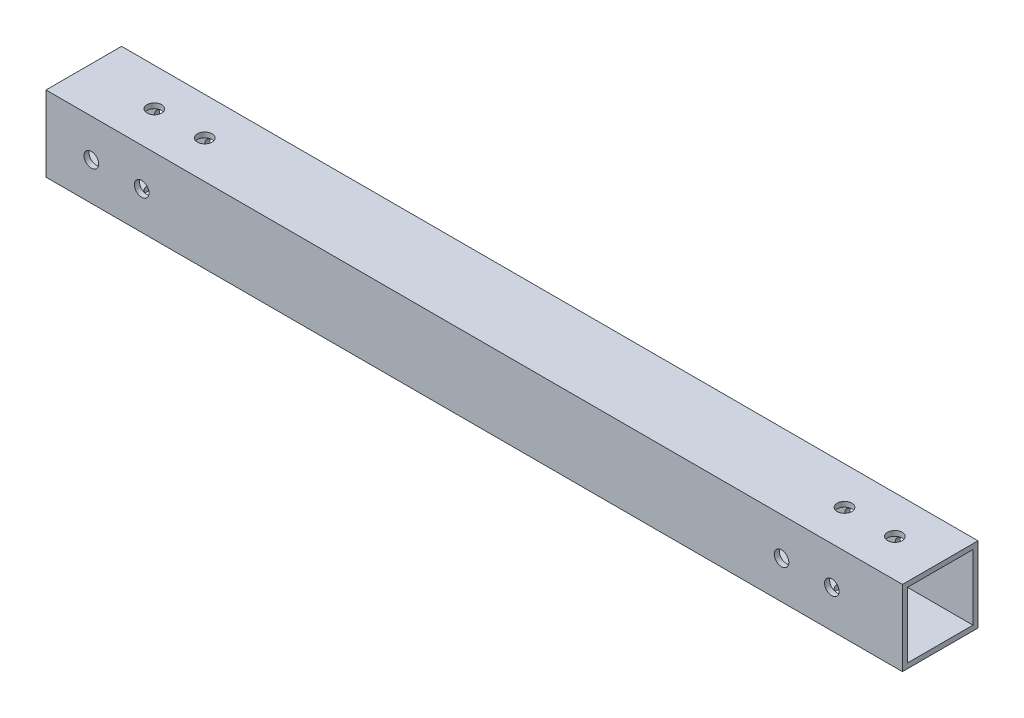
from build123d import *

# Parameters (mm, degrees)
SKETCH_1_W          = 15
SKETCH_1_H          = 15
SKETCH_1_W_2        = 13
SKETCH_1_H_2        = 13
EXTRUDE_1_DEPTH     = 170
SKETCH_2_R          = 1.45
CUT_EXTRUDE_1_DEPTH = 171.825203059
SKETCH_3_R          = 1.45
CUT_EXTRUDE_2_DEPTH = 171.825203059


with BuildPart() as part:
    # 草图1 → 凸台-拉伸1 (new body)
    with BuildSketch(Plane(origin=(0, 0, 0), x_dir=(0, 0, -1), z_dir=(1, 0, 0))):
        Rectangle(SKETCH_1_W, SKETCH_1_H)
        Rectangle(SKETCH_1_W_2, SKETCH_1_H_2, mode=Mode.SUBTRACT)
    extrude(amount=EXTRUDE_1_DEPTH)

    # 草图2 → 切除-拉伸1 (cut, through all)
    with BuildSketch(Plane(origin=(0, 0, -7.5), x_dir=(-1, 0, 0), z_dir=(0, 0, -1))):
        with Locations((-9, 0)):
            Circle(SKETCH_2_R)
        with Locations((-19, 0)):
            Circle(SKETCH_2_R)
        with Locations((-146, 0)):
            Circle(SKETCH_2_R)
        with Locations((-156, 0)):
            Circle(SKETCH_2_R)
    extrude(amount=-CUT_EXTRUDE_1_DEPTH, mode=Mode.SUBTRACT)

    # 草图3 → 切除-拉伸2 (cut, through all)
    with BuildSketch(Plane(origin=(0, 7.5, 0), x_dir=(1, 0, 0), z_dir=(0, 1, 0))):
        with Locations(Location((161, 0, 0), (0, 0, 270))):
            Circle(SKETCH_3_R)
        with Locations(Location((151, 0, 0), (0, 0, 270))):
            Circle(SKETCH_3_R)
        with Locations(Location((24, 0, 0), (0, 0, 270))):
            Circle(SKETCH_3_R)
        with Locations(Location((14, 0, 0), (0, 0, 270))):
            Circle(SKETCH_3_R)
    extrude(amount=-CUT_EXTRUDE_2_DEPTH, mode=Mode.SUBTRACT)


solid = part.part
